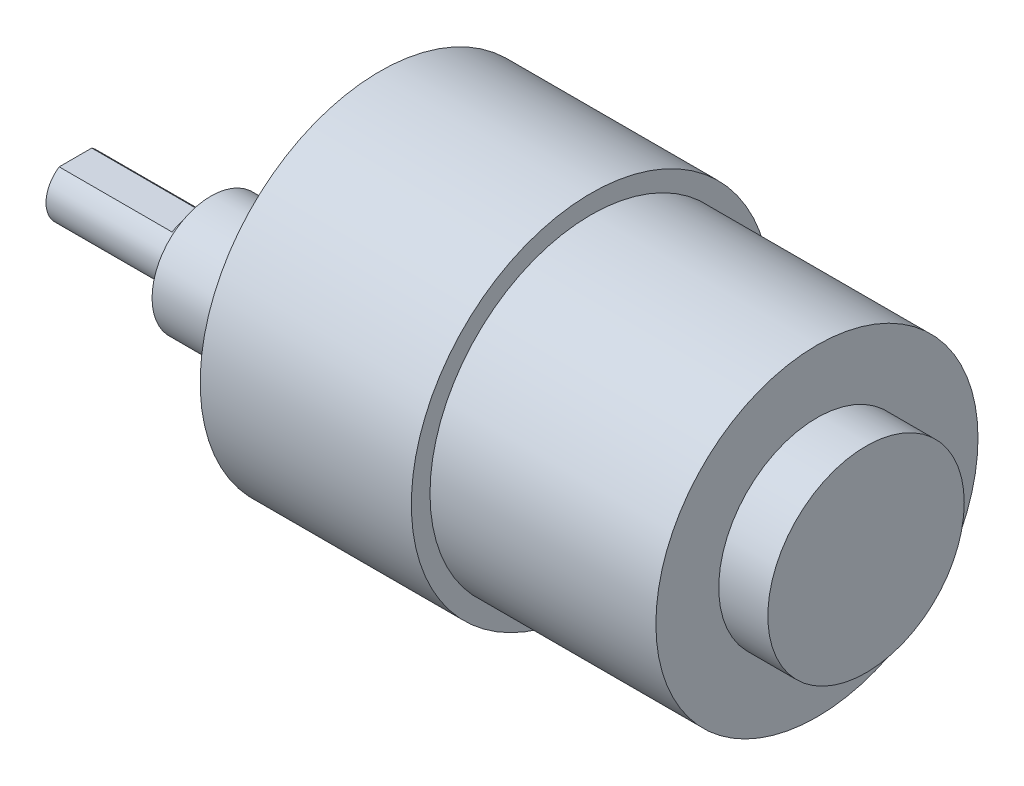
from build123d import *

# Parameters (mm, degrees)
SKETCH_1_R               = 3
EXTRUDE_1_DEPTH          = 13.8
SKETCH_2_R               = 6
EXTRUDE_2_DEPTH          = 9.9
SKETCH_3_R               = 18.3
EXTRUDE_3_DEPTH          = 21.5
SKETCH_4_R               = 16.4
EXTRUDE_4_DEPTH          = 23
SKETCH_5_R               = 10
EXTRUDE_5_DEPTH          = 5
CUT_EXTRUDE_1_DEPTH      = 11.5
SKETCH_7_R               = 1.5
CUT_EXTRUDE_2_DEPTH      = 5
PATTERN_CIRCULAR_1_COUNT = 6
SKETCH_8_R               = 8.963335845
CUT_EXTRUDE_3_DEPTH      = 23.7
SKETCH_9_R               = 6
EXTRUDE_6_DEPTH          = 9.9
SKETCH_10_R              = 3
EXTRUDE_7_DEPTH          = 13.8
CUT_EXTRUDE_4_DEPTH      = 11.5


with BuildPart() as part:
    # 草图1 → 凸台-拉伸1 (new body)
    with BuildSketch(Plane(origin=(0, 0, 0), x_dir=(0, 0, -1), z_dir=(1, 0, 0))):
        with Locations(Location((0, 0, 0), (0, 0, 180))):
            Circle(SKETCH_1_R)
    extrude(amount=EXTRUDE_1_DEPTH)

    # 草图2 → 凸台-拉伸2 (add)
    with BuildSketch(Plane(origin=(13.8, 0, 0), x_dir=(0, 0, -1), z_dir=(1, 0, 0))):
        Circle(SKETCH_2_R)
    extrude(amount=EXTRUDE_2_DEPTH)

    # 草图3 → 凸台-拉伸3 (add)
    with BuildSketch(Plane(origin=(23.7, 0, 0), x_dir=(0, 0, -1), z_dir=(1, 0, 0))):
        Circle(SKETCH_3_R)
    extrude(amount=EXTRUDE_3_DEPTH)

    # 草图4 → 凸台-拉伸4 (add)
    with BuildSketch(Plane(origin=(45.2, 0, 0), x_dir=(0, 0, -1), z_dir=(1, 0, 0))):
        Circle(SKETCH_4_R)
    extrude(amount=EXTRUDE_4_DEPTH)

    # 草图5 → 凸台-拉伸5 (add)
    with BuildSketch(Plane(origin=(68.2, 0, 0), x_dir=(0, 0, -1), z_dir=(1, 0, 0))):
        Circle(SKETCH_5_R)
    extrude(amount=EXTRUDE_5_DEPTH)

    # 草图6 → 切除-拉伸1 (cut)
    with BuildSketch(Plane.ZY):
        Polygon((-1.658312395, 2.5), (1.658312395, 2.5), (1.914814447, 4.033173691), (-2.453659142, 4.033173691), align=None)
    extrude(amount=-CUT_EXTRUDE_1_DEPTH, mode=Mode.SUBTRACT)

    # 草图7 → 切除-拉伸2 (cut)
    with BuildSketch(Plane.ZY.offset(-23.7)):
        with Locations((0, 15.5)):
            Circle(SKETCH_7_R)
    cut_extrude_2 = extrude(amount=-CUT_EXTRUDE_2_DEPTH, mode=Mode.SUBTRACT)

    # 阵列(圆周)1: 切除-拉伸2 ×6 about axis
    pattern_circular_1_axis = Axis((0, 0, 0), (1, 0, 0))
    for i in range(1, PATTERN_CIRCULAR_1_COUNT):
        add(cut_extrude_2.rotate(pattern_circular_1_axis, i * 360 / PATTERN_CIRCULAR_1_COUNT), mode=Mode.SUBTRACT)

    # 草图8 → 切除-拉伸3 (cut)
    with BuildSketch(Plane.ZY):
        Circle(SKETCH_8_R)
    extrude(amount=-CUT_EXTRUDE_3_DEPTH, mode=Mode.SUBTRACT)

    # 草图9 → 凸台-拉伸6 (add)
    with BuildSketch(Plane.ZY.offset(-23.7)):
        with Locations(Location((7.3, 0, 0), (0, 0, 180))):
            Circle(SKETCH_9_R)
    extrude(amount=EXTRUDE_6_DEPTH)

    # 草图10 → 凸台-拉伸7 (add)
    with BuildSketch(Plane.ZY.offset(-13.8)):
        with Locations(Location((7.3, 0, 0), (0, 0, 180))):
            Circle(SKETCH_10_R)
    extrude(amount=EXTRUDE_7_DEPTH)

    # 草图11 → 切除-拉伸4 (cut)
    with BuildSketch(Plane.ZY):
        Polygon((5.641687605, 2.5), (8.958312395, 2.5), (9.936132203, 4.4850308), (5.641687605, 3.798836175), align=None)
    extrude(amount=-CUT_EXTRUDE_4_DEPTH, mode=Mode.SUBTRACT)


solid = part.part
